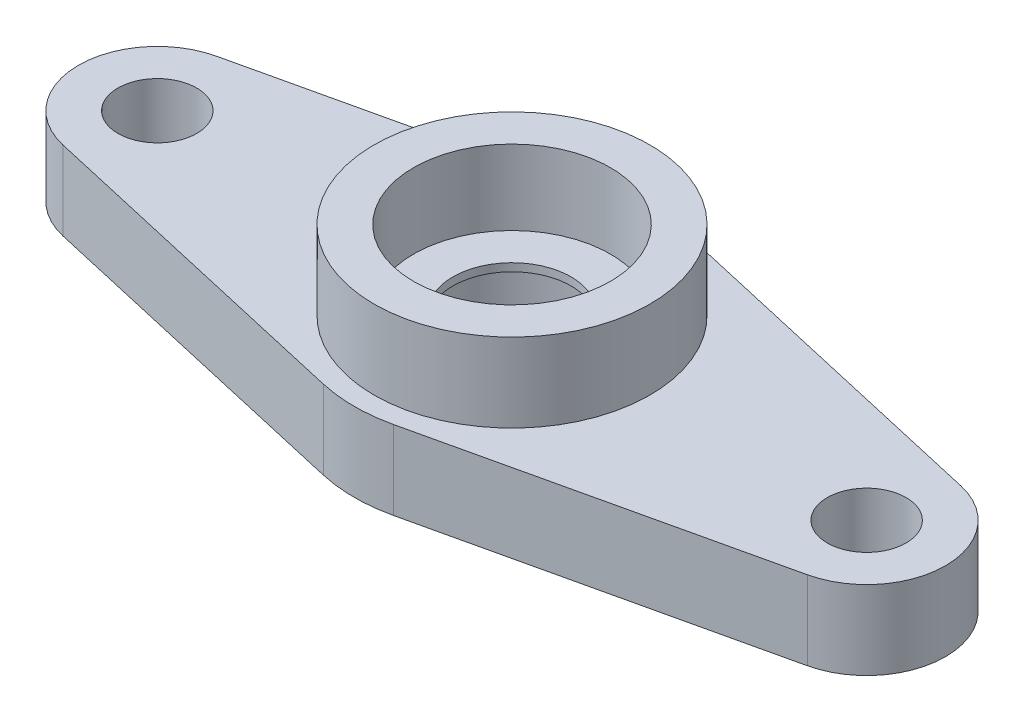
from build123d import *

# Parameters (mm, degrees)
SKETCH_1_R           = 2.5
SKETCH_1_R_2         = 1
EXTRUDE_1_DEPTH      = 2
SKETCH_2_R           = 3.5
SKETCH_2_R_2         = 2.5
EXTRUDE_2_DEPTH      = 2
EXTRUDE_3_DEPTH      = 0.1
EXTRUDE_3_DEPTH_BACK = 0.1
SKETCH_3_R           = 2.5
SKETCH_3_R_2         = 1.5


with BuildPart() as part:
    # 草圖1 → 填料-伸長1 (new body)
    with BuildSketch(Plane(origin=(0, 0, 0), x_dir=(1, 0, 0), z_dir=(0, 1, 0))):
        with BuildLine():
            Line((-9.444444444, 1.949992086), (-0.888888889, 3.899984172))
            ThreePointArc((-0.888888889, 3.899984172), (0, 4), (0.888888889, 3.899984172))
            Line((0.888888889, 3.899984172), (9.444444444, 1.949992086))
            ThreePointArc((9.444444444, 1.949992086), (11, 0), (9.444444444, -1.949992086))
            Line((9.444444444, -1.949992086), (0.888888889, -3.899984172))
            ThreePointArc((0.888888889, -3.899984172), (0, -4), (-0.888888889, -3.899984172))
            Line((-0.888888889, -3.899984172), (-9.444444444, -1.949992086))
            ThreePointArc((-9.444444444, -1.949992086), (-11, 0), (-9.444444444, 1.949992086))
        make_face()
        with Locations(Location((0, 0, 0), (0, 0, 270))):
            Circle(SKETCH_1_R, mode=Mode.SUBTRACT)
        with Locations(Location((-9, 0, 0), (0, 0, 270))):
            Circle(SKETCH_1_R_2, mode=Mode.SUBTRACT)
        with Locations(Location((9, 0, 0), (0, 0, 270))):
            Circle(SKETCH_1_R_2, mode=Mode.SUBTRACT)
    extrude(amount=EXTRUDE_1_DEPTH)

    # 草圖2 → 填料-伸長2 (add)
    with BuildSketch(Plane(origin=(0, 2, 0), x_dir=(1, 0, 0), z_dir=(0, 1, 0))):
        with Locations(Location((0, 0, 0), (0, 0, 270))):
            Circle(SKETCH_2_R)
        with Locations(Location((0, 0, 0), (0, 0, 270))):
            Circle(SKETCH_2_R_2, mode=Mode.SUBTRACT)
    extrude(amount=EXTRUDE_2_DEPTH)

    # 草圖3 → 填料-伸長3 (add, two sides: drawn at the far end of the back side and taken through both)
    with BuildSketch(Plane(origin=(0, 2, 0), x_dir=(1, 0, 0), z_dir=(0, 1, 0)).offset(-EXTRUDE_3_DEPTH_BACK)):
        with Locations(Location((0, 0, 0), (0, 0, 270))):
            Circle(SKETCH_3_R)
        with Locations(Location((0, 0, 0), (0, 0, 270))):
            Circle(SKETCH_3_R_2, mode=Mode.SUBTRACT)
    extrude(amount=EXTRUDE_3_DEPTH + EXTRUDE_3_DEPTH_BACK)


solid = part.part
